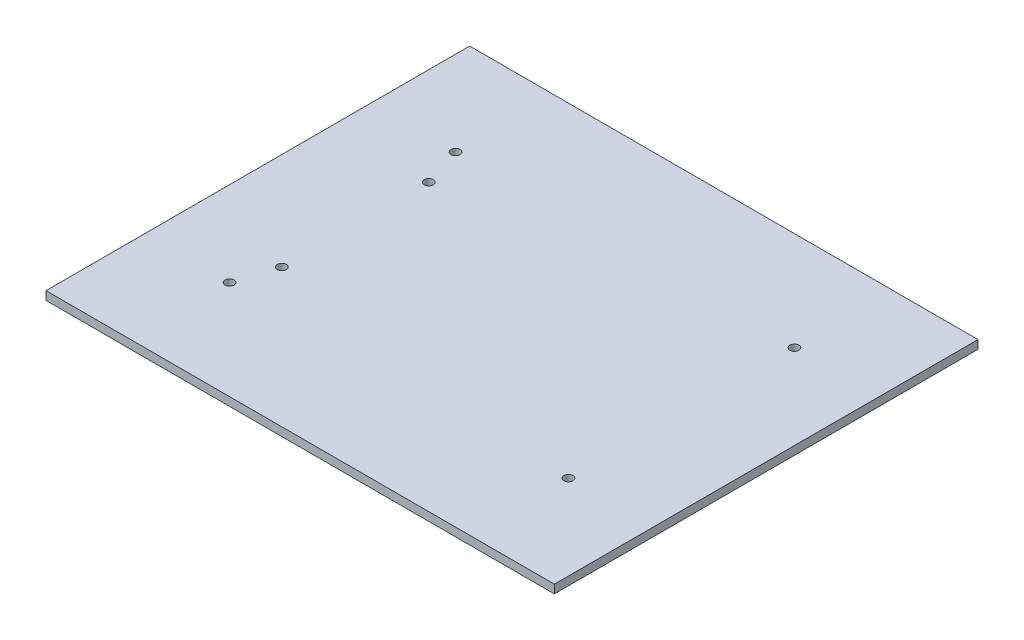
from build123d import *

# Parameters (mm, degrees)
SKETCH1_W           = 180
SKETCH1_H           = 150
SKETCH1_R           = 1.6
BOSS_EXTRUDE1_DEPTH = 3


with BuildPart() as part:
    # Sketch1 → Boss-Extrude1 (new body)
    with BuildSketch(Plane(origin=(0, 0, 0), x_dir=(1, 0, 0), z_dir=(0, 1, 0))):
        Rectangle(SKETCH1_W, SKETCH1_H)
        with Locations(Location((-60, -40, 0), (0, 0, 270))):
            Circle(SKETCH1_R, mode=Mode.SUBTRACT)
        with Locations(Location((-60, 40, 0), (0, 0, 270))):
            Circle(SKETCH1_R, mode=Mode.SUBTRACT)
        with Locations(Location((60, -40, 0), (0, 0, 270))):
            Circle(SKETCH1_R, mode=Mode.SUBTRACT)
        with Locations(Location((60, 40, 0), (0, 0, 270))):
            Circle(SKETCH1_R, mode=Mode.SUBTRACT)
        with Locations(Location((-55.5, -26, 0), (0, 0, 270))):
            Circle(SKETCH1_R, mode=Mode.SUBTRACT)
        with Locations(Location((-55.5, 26, 0), (0, 0, 270))):
            Circle(SKETCH1_R, mode=Mode.SUBTRACT)
    extrude(amount=BOSS_EXTRUDE1_DEPTH)


solid = part.part
